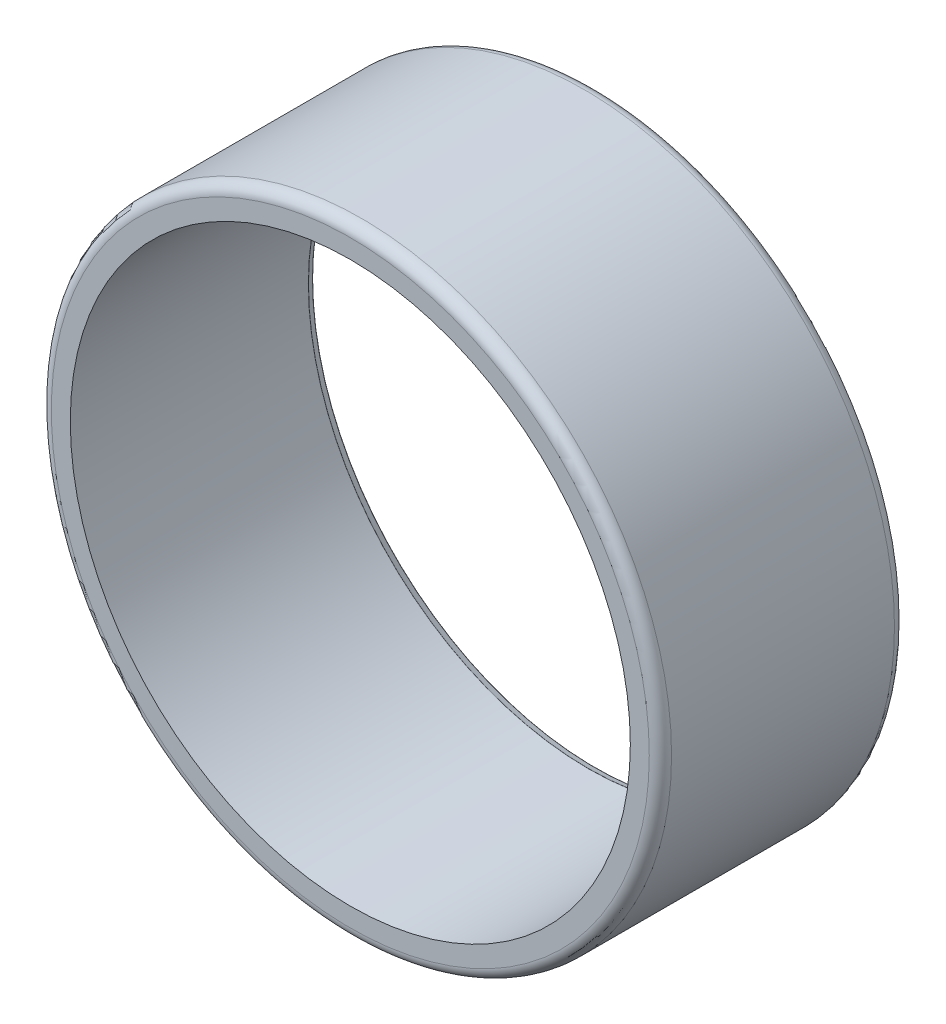
from build123d import *

# Parameters (mm, degrees)
FILLET1_R = 0.1


with BuildPart() as part:
    # Sketch1 → Revolve1 (revolve)
    with BuildSketch(Plane(origin=(0, 0, 0), x_dir=(0, 0, -1), z_dir=(1, 0, 0)), mode=Mode.PRIVATE) as revolve1_sk:
        with BuildLine():
            Line((10, 27.825), (-10, 27.825))
            ThreePointArc((-10, 27.825), (-10.707106781, 27.532106781), (-11, 26.825))
            Line((-11, 26.825), (-11, 25.125))
            Line((-11, 25.125), (10.368080194, 25.125))
            Line((10.368080194, 25.125), (11, 25.355))
            Line((11, 25.355), (11, 26.825))
            ThreePointArc((11, 26.825), (10.707106781, 27.532106781), (10, 27.825))
        make_face()
    revolve(revolve1_sk.sketch.rotate(Axis((0, 0, 55), (0, 0, -1)), 90), axis=Axis((0, 0, 55), (0, 0, -1)))

    # Fillet1
    fillet1_edges = [part.edges().sort_by_distance(p)[0] for p in [
        (-25.355, 0, -11),
        (-25.125, 0, -10.368080194),
    ]]
    fillet(fillet1_edges, radius=FILLET1_R)


solid = part.part
